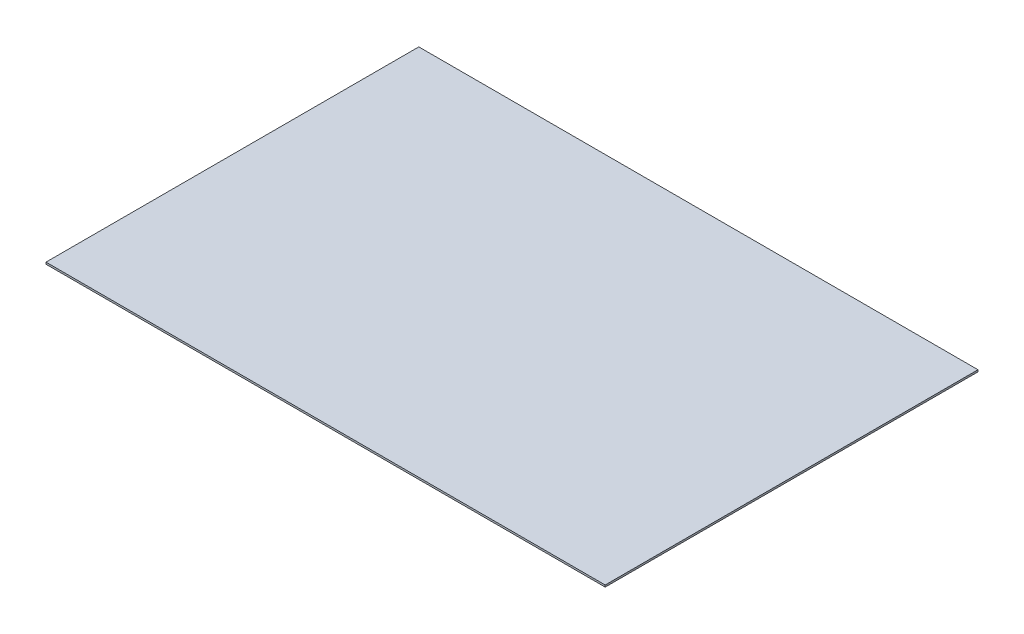
from build123d import *

# Parameters (mm, degrees)
SKETCH1_W           = 600
SKETCH1_H           = 400
BOSS_EXTRUDE1_DEPTH = 2


with BuildPart() as part:
    # Sketch1 → Boss-Extrude1 (new body)
    with BuildSketch(Plane(origin=(0, 0, 0), x_dir=(1, 0, 0), z_dir=(0, 1, 0))):
        with Locations((300, 200)):
            Rectangle(SKETCH1_W, SKETCH1_H)
    extrude(amount=BOSS_EXTRUDE1_DEPTH)


solid = part.part
